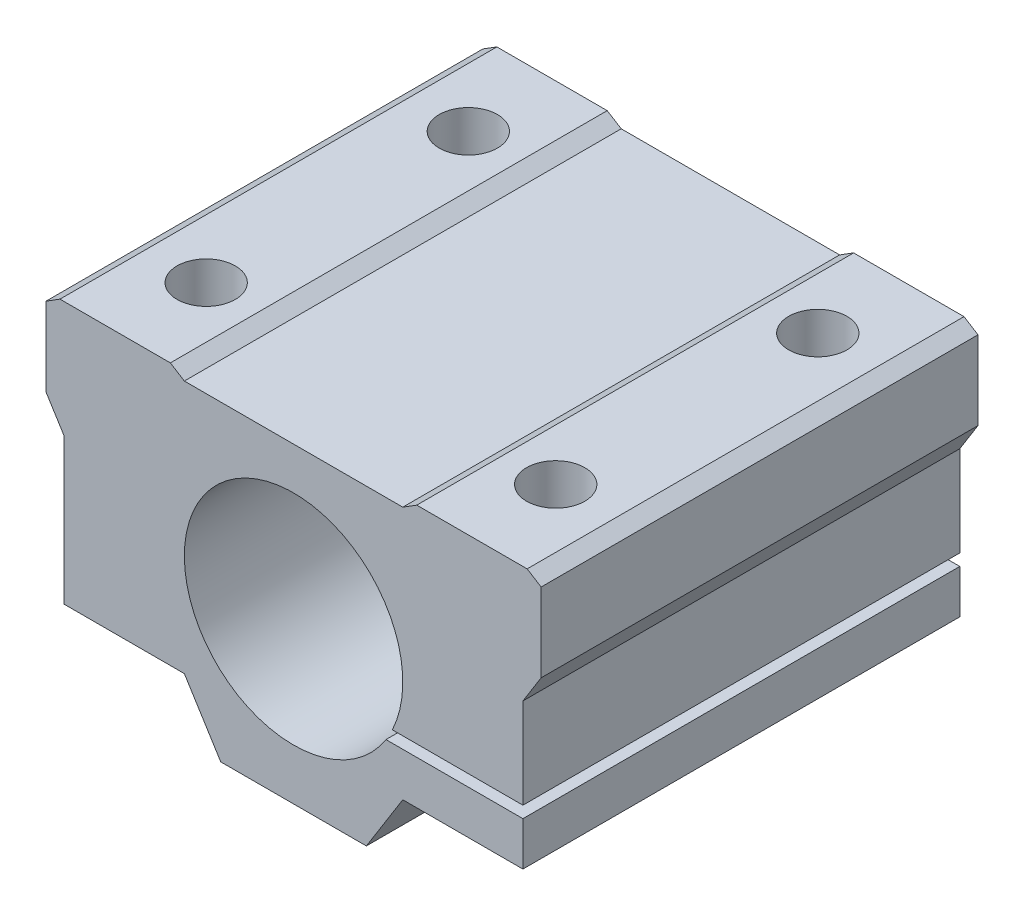
from build123d import *

# Parameters (mm, degrees)
CROQUIS1_R              = 7.5
SALIENTE_EXTRUIR1_DEPTH = 30
CROQUIS2_W              = 12
CROQUIS2_H              = 0.8
CORTAR_EXTRUIR1_DEPTH   = 37.193922142
CROQUIS3_R              = 1.05
CORTAR_EXTRUIR2_DEPTH   = 10
CROQUIS4_R              = 1.7
CORTAR_EXTRUIR3_DEPTH   = 41.902322672
CROQUIS5_R              = 2
CORTAR_EXTRUIR4_DEPTH   = 8


with BuildPart() as part:
    # Croquis1 → Saliente-Extruir1 (new body)
    with BuildSketch(Plane.XY):
        Polygon((-5, -11), (5, -11), (7.5, -7), (15.75, -7), (15.75, 3), (17, 5), (17, 10.4), (16.04, 11), (8.46, 11), (7.5, 10.4), (-7.5, 10.4), (-8.46, 11), (-16.04, 11), (-17, 10.4), (-17, 5), (-15.75, 3), (-15.75, -7), (-7.5, -7), align=None)
        Circle(CROQUIS1_R, mode=Mode.SUBTRACT)
    extrude(amount=SALIENTE_EXTRUIR1_DEPTH)

    # Croquis2 → Cortar-Extruir1 (cut, through all)
    with BuildSketch(Plane.XY.offset(30)):
        with Locations((11, -3.6)):
            Rectangle(CROQUIS2_W, CROQUIS2_H)
    extrude(amount=-CORTAR_EXTRUIR1_DEPTH, mode=Mode.SUBTRACT)

    # Croquis3 → Cortar-Extruir2 (cut)
    with BuildSketch(Plane.XZ.offset(7)):
        with Locations((11.625, 15)):
            Circle(CROQUIS3_R)
    extrude(amount=-CORTAR_EXTRUIR2_DEPTH, mode=Mode.SUBTRACT)

    # Croquis4 → Cortar-Extruir3 (cut, through all)
    with BuildSketch(Plane(origin=(0, 11, 0), x_dir=(1, 0, 0), z_dir=(0, 1, 0))):
        with Locations(Location((12, -6, 0), (0, 0, 180))):
            Circle(CROQUIS4_R)
        with Locations(Location((-12, -6, 0), (0, 0, 180))):
            Circle(CROQUIS4_R)
        with Locations(Location((-12, -24, 0), (0, 0, 180))):
            Circle(CROQUIS4_R)
        with Locations(Location((12, -24, 0), (0, 0, 180))):
            Circle(CROQUIS4_R)
    extrude(amount=-CORTAR_EXTRUIR3_DEPTH, mode=Mode.SUBTRACT)

    # Croquis5 → Cortar-Extruir4 (cut)
    with BuildSketch(Plane(origin=(0, 11, 0), x_dir=(1, 0, 0), z_dir=(0, 1, 0))):
        with Locations(Location((12, -6, 0), (0, 0, 180))):
            Circle(CROQUIS5_R)
        with Locations((-12, -6)):
            Circle(CROQUIS5_R)
        with Locations(Location((-12, -24, 0), (0, 0, 180))):
            Circle(CROQUIS5_R)
        with Locations((12, -24)):
            Circle(CROQUIS5_R)
    extrude(amount=-CORTAR_EXTRUIR4_DEPTH, mode=Mode.SUBTRACT)


solid = part.part
